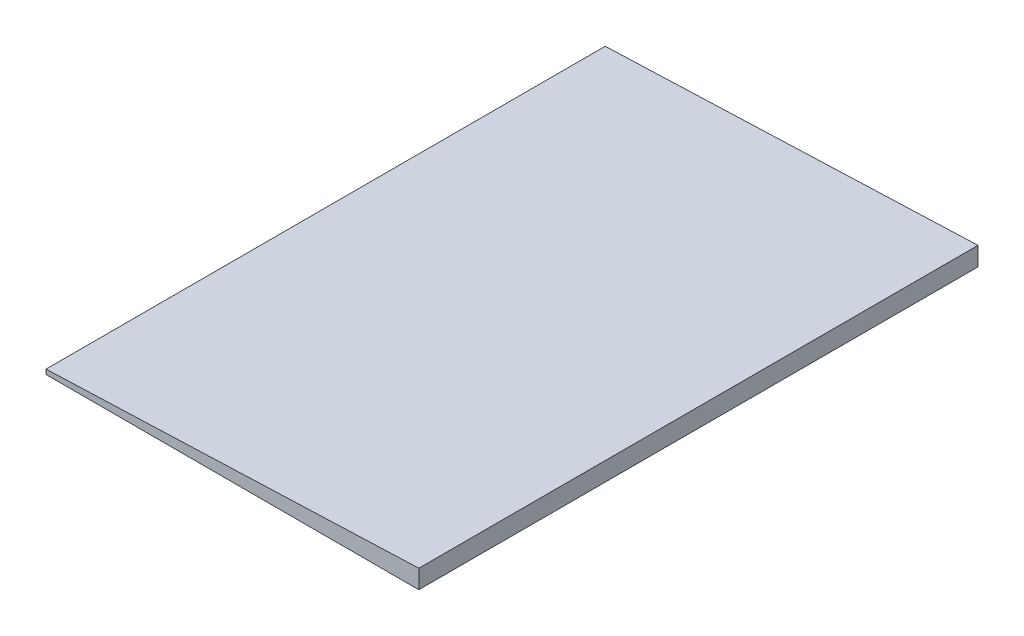
from build123d import *

# Parameters (mm, degrees)
SKETCH_1_W          = 105
SKETCH_1_H          = 120
EXTRUDE_1_DEPTH     = 4
SKETCH_4_W          = 25
SKETCH_4_H          = 4
CUT_EXTRUDE_1_DEPTH = 155
CUT_EXTRUDE_3_DEPTH = 155
SHELL_1_T           = -1


with BuildPart() as part:
    # 스케치1 → 보스-돌출1 (new body)
    with BuildSketch(Plane(origin=(0, 0, 0), x_dir=(1, 0, 0), z_dir=(0, 1, 0))):
        Rectangle(SKETCH_1_W, SKETCH_1_H)
    extrude(amount=EXTRUDE_1_DEPTH)

    # 스케치4 → 컷-돌출1 (cut)
    with BuildSketch(Plane.XY.offset(60)):
        with Locations((40, 2)):
            Rectangle(SKETCH_4_W, SKETCH_4_H)
    extrude(amount=-CUT_EXTRUDE_1_DEPTH, mode=Mode.SUBTRACT)

    # 스케치6 → 컷-돌출3 (cut)
    with BuildSketch(Plane.XY.offset(60)):
        Polygon((-52.5, 4), (-52.5, 1), (27.5, 4), align=None)
    extrude(amount=-CUT_EXTRUDE_3_DEPTH, mode=Mode.SUBTRACT)

    # 쉘1
    shell_1_openings = [part.faces().sort_by_distance(p)[0] for p in [
        (-12.5, 0, 0),
    ]]
    offset(amount=SHELL_1_T, openings=shell_1_openings, kind=Kind.INTERSECTION)


solid = part.part
